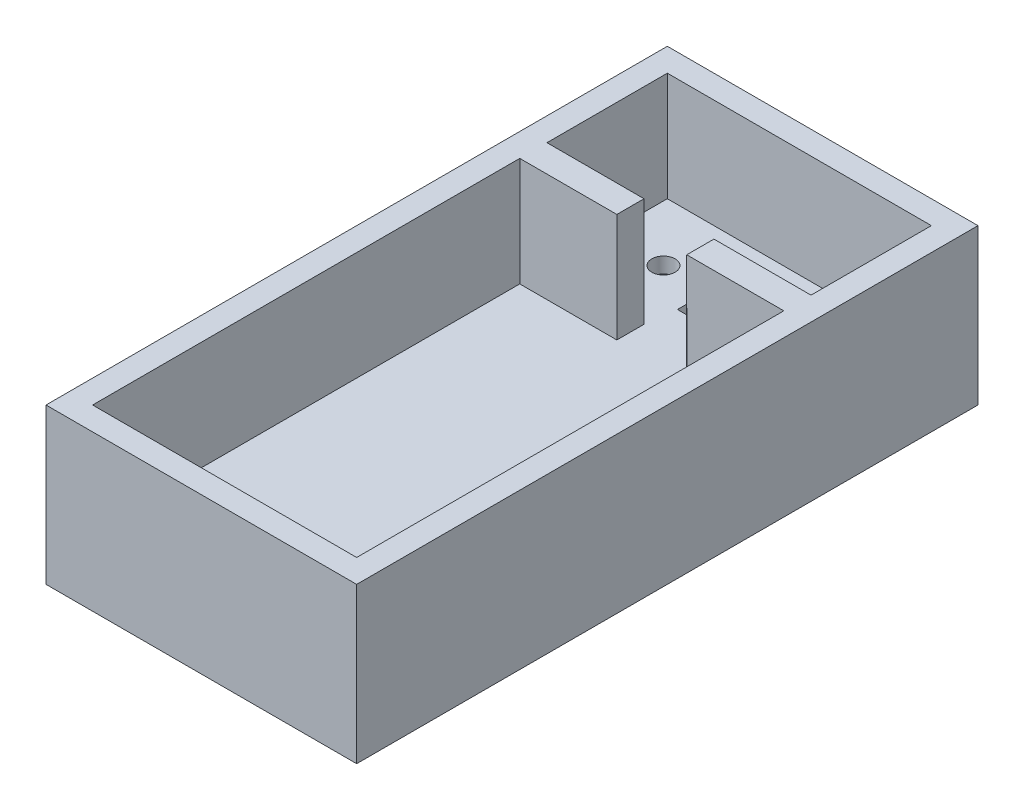
from build123d import *

# Parameters (mm, degrees)
SKETCH1_W                = 40
SKETCH1_H                = 80
SKETCH1_W_2              = 8
SKETCH1_H_2              = 4
SKETCH1_R                = 1.5
INITIAL_EXTRUDE_DEPTH    = 20
MAIN_START               = 6
SKETCH1_3_W              = 8
SKETCH1_3_H              = 4
SKETCH1_3_R              = 1.5
MAIN_CAVITY_DEPTH        = 43.989794856
SKETCH1_4_R              = 1.5
NUT_CAPTURE_BOTTOM_DEPTH = 4
SENSOR_HOLE_CHAMFER_SIZE = 1
SKETCH3_W                = 16
SKETCH3_H                = 3
GPIO_CUTOUT_SENSOR_DEPTH = 3


with BuildPart() as part:
    # Sketch1 → Initial Extrude (new body)
    with BuildSketch(Plane(origin=(0, 0, 0), x_dir=(1, 0, 0), z_dir=(0, 1, 0))):
        Rectangle(SKETCH1_W, SKETCH1_H)
        with Locations((0, 27.300592934)):
            Rectangle(SKETCH1_W_2, SKETCH1_H_2, mode=Mode.SUBTRACT)
        with Locations((-9.800487558, 29.300592934)):
            Circle(SKETCH1_R, mode=Mode.SUBTRACT)
        with Locations((9.800487558, 29.300592934)):
            Circle(SKETCH1_R, mode=Mode.SUBTRACT)
    extrude(amount=INITIAL_EXTRUDE_DEPTH)

    # Sketch1<3> → Main Cavity (cut, through all)
    with BuildSketch(Plane(origin=(0, 0, 0), x_dir=(1, 0, 0), z_dir=(0, 1, 0)).offset(MAIN_START)):
        Polygon((-17, -37), (17, -37), (17, 18), (4.5, 18), (4.5, 21.5), (17, 21.5), (17, 37), (-17, 37), (-17, 21.5), (-4.5, 21.5), (-4.5, 18), (-17, 18), align=None)
        with Locations((0, 27.300592934)):
            Rectangle(SKETCH1_3_W, SKETCH1_3_H, mode=Mode.SUBTRACT)
        with Locations((-9.800487558, 29.300592934)):
            Circle(SKETCH1_3_R, mode=Mode.SUBTRACT)
        with Locations((9.800487558, 29.300592934)):
            Circle(SKETCH1_3_R, mode=Mode.SUBTRACT)
    extrude(amount=MAIN_CAVITY_DEPTH, mode=Mode.SUBTRACT)

    # Sketch1<4> → Nut Capture Bottom (cut)
    # profile 1 of 2: a face of its own
    with BuildSketch(Plane(origin=(0, 0, 0), x_dir=(1, 0, 0), z_dir=(0, 1, 0))):
        Polygon((-7.050487558, 30.888306174), (-9.800487558, 32.476019414), (-12.550487558, 30.888306174), (-12.550487558, 27.712879693), (-9.800487558, 26.125166453), (-7.050487558, 27.712879693), align=None)
        with Locations((-9.800487558, 29.300592934)):
            Circle(SKETCH1_4_R, mode=Mode.SUBTRACT)
    # profile 2 of 2: a face of its own
    with BuildSketch(Plane(origin=(0, 0, 0), x_dir=(1, 0, 0), z_dir=(0, 1, 0))):
        Polygon((12.550487558, 30.888306174), (9.800487558, 32.476019414), (7.050487558, 30.888306174), (7.050487558, 27.712879693), (9.800487558, 26.125166453), (12.550487558, 27.712879693), align=None)
        with Locations((9.800487558, 29.300592934)):
            Circle(SKETCH1_4_R, mode=Mode.SUBTRACT)
    extrude(amount=NUT_CAPTURE_BOTTOM_DEPTH, mode=Mode.SUBTRACT)

    # Sensor Hole Chamfer
    sensor_hole_chamfer_edges = [part.edges().sort_by_distance(p)[0] for p in [
        (0, 0, -25.300592934),
        (-4, 0, -27.300592934),
        (0, 0, -29.300592934),
        (4, 0, -27.300592934),
    ]]
    chamfer(sensor_hole_chamfer_edges, length=SENSOR_HOLE_CHAMFER_SIZE)

    # Sketch3 → GPIO Cutout Sensor (cut)
    with BuildSketch(Plane(origin=(0, 6, 0), x_dir=(1, 0, 0), z_dir=(0, 1, 0))):
        with Locations((0, 33.5)):
            Rectangle(SKETCH3_W, SKETCH3_H)
    extrude(amount=-GPIO_CUTOUT_SENSOR_DEPTH, mode=Mode.SUBTRACT)


solid = part.part
